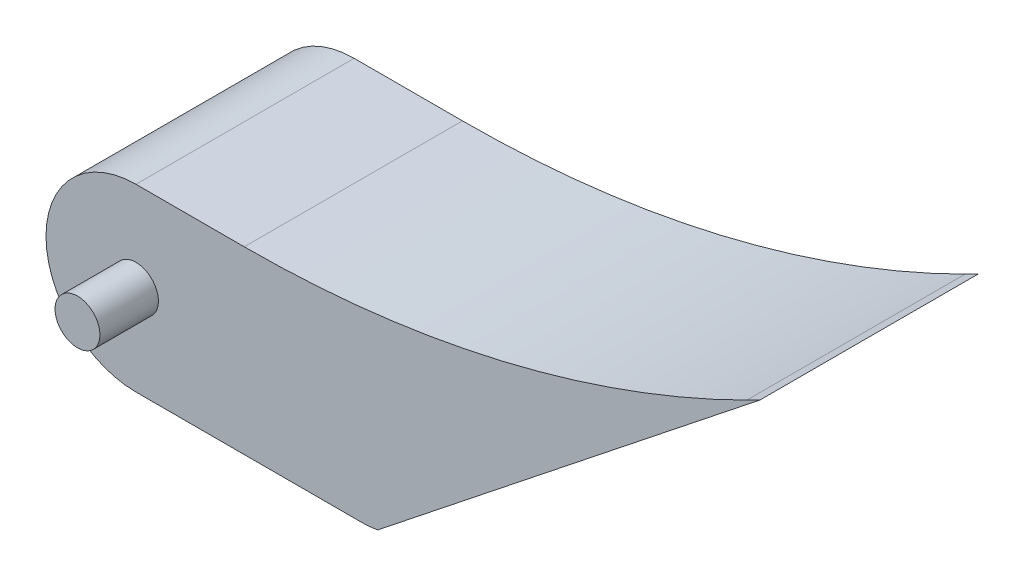
from build123d import *

# Parameters (mm, degrees)
SALIENTE_EXTRUIR2_DEPTH      = 97
REDONDEO2_R                  = 500
SALIENTE_EXTRUIR3_DEPTH      = 26
SALIENTE_EXTRUIR3_DEPTH_BACK = 123
CROQUIS2_R                   = 9.966


with BuildPart() as part:
    # Croquis1 → Saliente-Extruir2 (new body)
    with BuildSketch(Plane.XY):
        with BuildLine():
            Line((0, 40), (100.180824208, 40))
            ThreePointArc((100.180824208, 40), (118.45024357, 35.584102014), (132.685868325, 23.311415808))
            Line((132.685868325, 23.311415808), (277.355906926, 95.588111944))
            Line((277.355906926, 95.588111944), (107.503389255, -39.324038973))
            ThreePointArc((107.503389255, -39.324038973), (103.857673476, -39.830651256), (100.180824208, -40))
            Line((100.180824208, -40), (0, -40))
            ThreePointArc((0, -40), (-40, 0), (0, 40))
        make_face()
    extrude(amount=SALIENTE_EXTRUIR2_DEPTH)

    # Redondeo2
    redondeo2_edges = [part.edges().sort_by_distance(p)[0] for p in [
        (132.685868325, 23.311415808, 48.5),
    ]]
    fillet(redondeo2_edges, radius=REDONDEO2_R)

    # Croquis2 → Saliente-Extruir3 (add, two sides: drawn at the far end of the back side and taken through both)
    with BuildSketch(Plane(origin=(0, 0, 0), x_dir=(-1, 0, 0), z_dir=(0, 0, -1)).offset(-SALIENTE_EXTRUIR3_DEPTH_BACK)):
        Circle(CROQUIS2_R)
    extrude(amount=SALIENTE_EXTRUIR3_DEPTH + SALIENTE_EXTRUIR3_DEPTH_BACK)


solid = part.part
